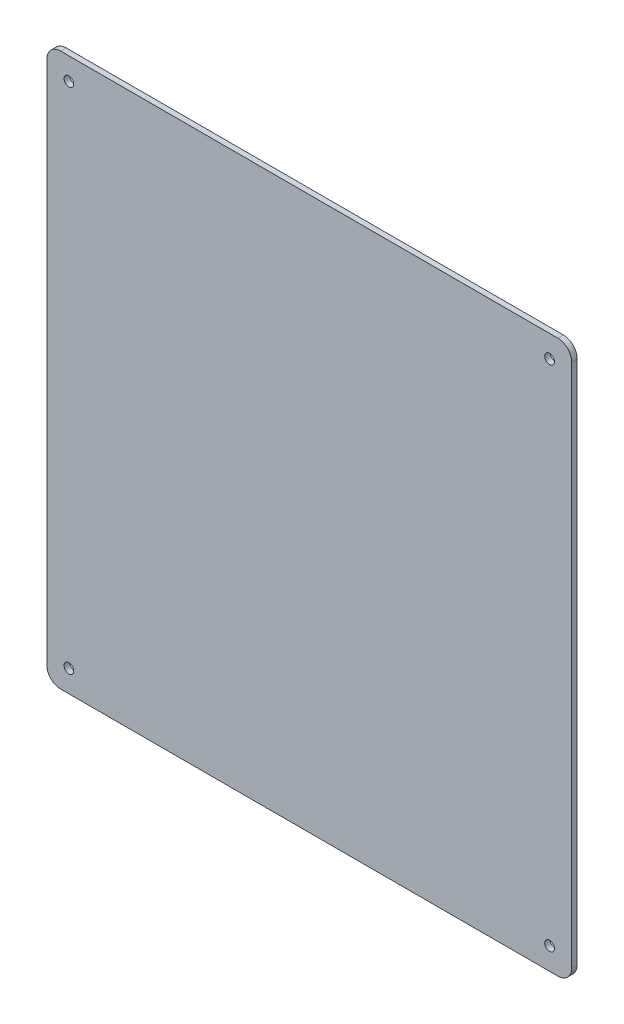
from build123d import *

# Parameters (mm, degrees)
SKETCH_1_W          = 190
SKETCH_1_H          = 200
EXTRUDE_1_DEPTH     = 2
SKETCH_2_R          = 1.75
CUT_EXTRUDE_1_DEPTH = 184.422906641
FILLET_1_R          = 5


with BuildPart() as part:
    # 草图1 → 凸台-拉伸1 (new body)
    with BuildSketch(Plane.XY):
        with Locations((-38.612137779, -25.649350649)):
            Rectangle(SKETCH_1_W, SKETCH_1_H)
    extrude(amount=EXTRUDE_1_DEPTH)

    # 草图2 → 切除-拉伸1 (cut, through all)
    with BuildSketch(Plane.XY.offset(2)):
        with Locations((-125.612137779, 66.350649351)):
            Circle(SKETCH_2_R)
        with Locations((48.387862221, 66.350649351)):
            Circle(SKETCH_2_R)
        with Locations((-125.612137779, -117.649350649)):
            Circle(SKETCH_2_R)
        with Locations((48.387862221, -117.649350649)):
            Circle(SKETCH_2_R)
    extrude(amount=-CUT_EXTRUDE_1_DEPTH, mode=Mode.SUBTRACT)

    # 圆角1
    fillet_1_edges = [part.edges().sort_by_distance(p)[0] for p in [
        (-133.612137779, 74.350649351, 1),
        (56.387862221, 74.350649351, 1),
        (56.387862221, -125.649350649, 1),
        (-133.612137779, -125.649350649, 1),
    ]]
    fillet(fillet_1_edges, radius=FILLET_1_R)


solid = part.part
